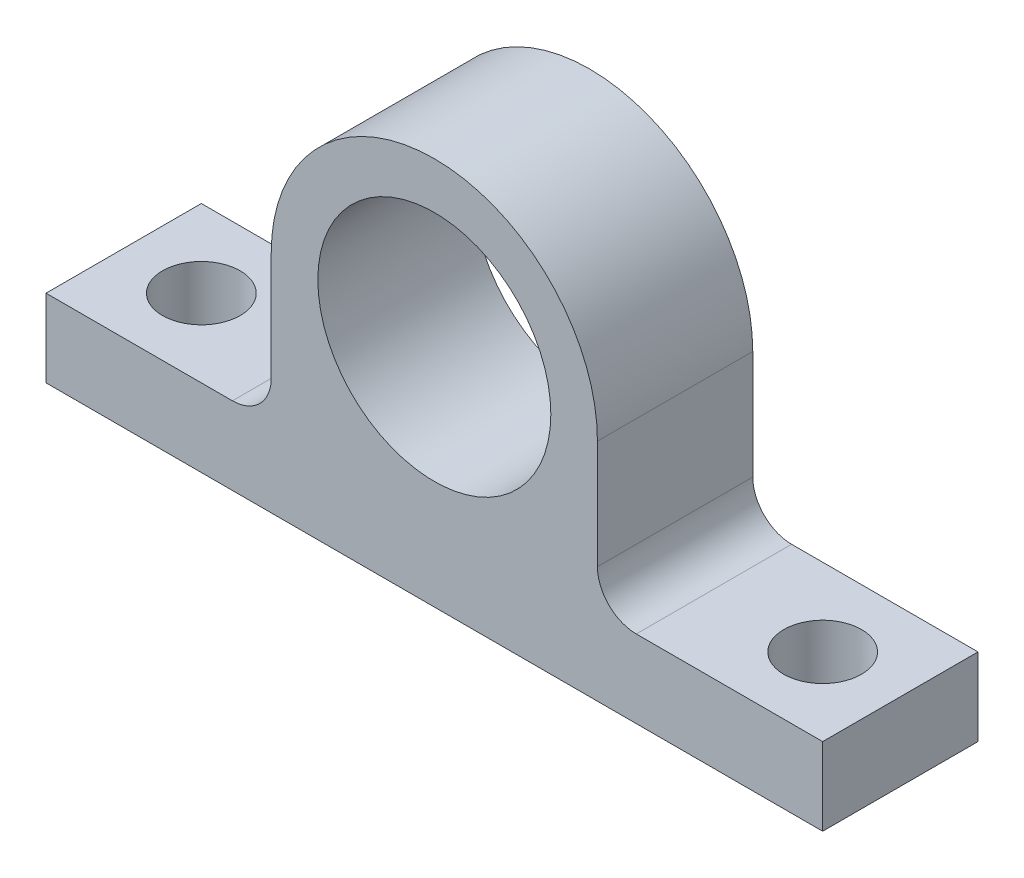
from build123d import *

# Parameters (mm, degrees)
SKETCH1_R           = 7.5
BOSS_EXTRUDE1_DEPTH = 10
SKETCH3_R           = 2.5
CUT_EXTRUDE1_DEPTH  = 22


with BuildPart() as part:
    # Sketch1 → Boss-Extrude1 (new body)
    with BuildSketch(Plane.XY):
        with BuildLine():
            Line((25, 0), (-25, 0))
            Line((-25, 0), (-25, 5))
            Line((-25, 5), (-13, 5))
            ThreePointArc((-13, 5), (-11.232233047, 5.732233047), (-10.5, 7.5))
            Line((-10.5, 7.5), (-10.5, 14.5))
            ThreePointArc((-10.5, 14.5), (0, 25), (10.5, 14.5))
            Line((10.5, 14.5), (10.5, 7.5))
            ThreePointArc((10.5, 7.5), (11.232233047, 5.732233047), (13, 5))
            Line((13, 5), (25, 5))
            Line((25, 5), (25, 0))
        make_face()
        with Locations((0, 14.5)):
            Circle(SKETCH1_R, mode=Mode.SUBTRACT)
    extrude(amount=BOSS_EXTRUDE1_DEPTH)

    # Sketch3 → Cut-Extrude1 (cut)
    with BuildSketch(Plane(origin=(0, 5, 0), x_dir=(1, 0, 0), z_dir=(0, 1, 0))):
        with Locations(Location((-20, -5, 0), (0, 0, 270))):
            Circle(SKETCH3_R)
        with Locations(Location((20, -5, 0), (0, 0, 270))):
            Circle(SKETCH3_R)
    extrude(amount=-CUT_EXTRUDE1_DEPTH, mode=Mode.SUBTRACT)


solid = part.part
